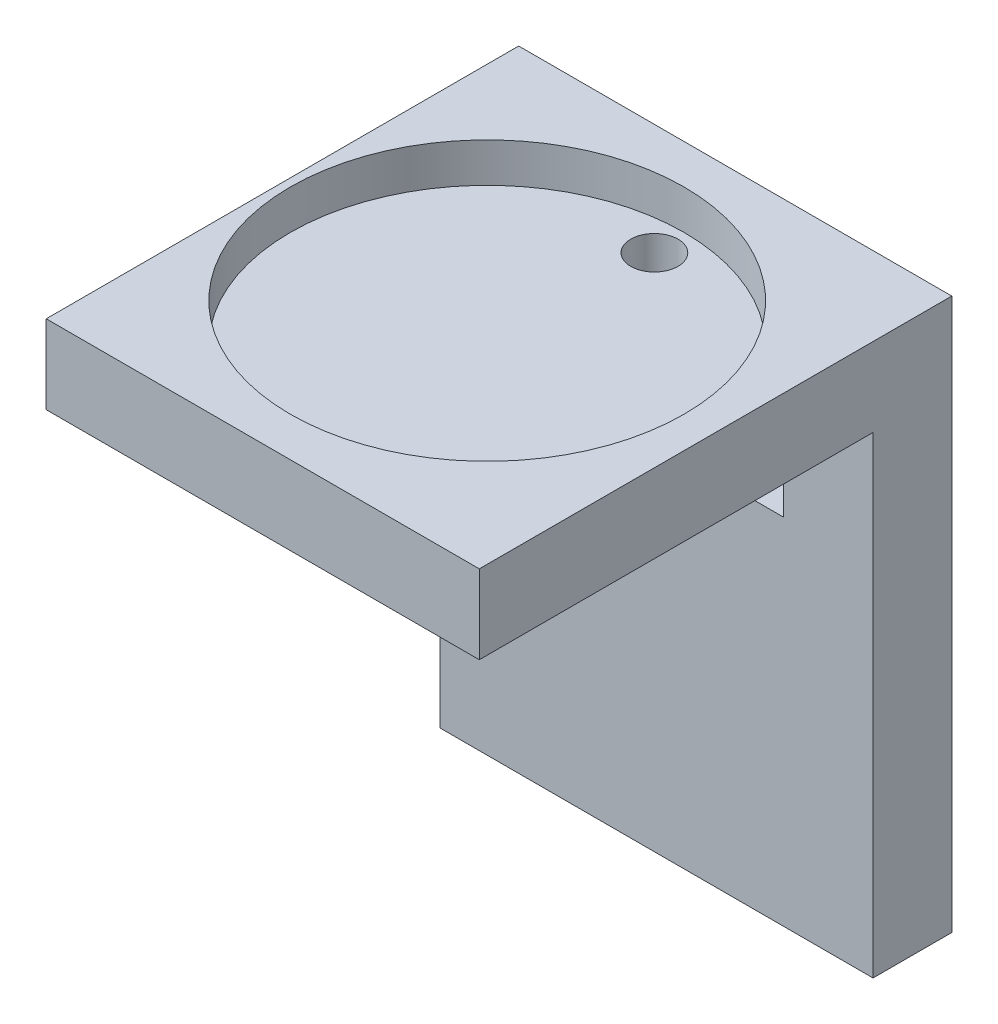
from build123d import *

# Parameters (mm, degrees)
SKETCH1_W                      = 670
SKETCH1_H                      = 120
BOSS_EXTRUDE1_DEPTH            = 530
SKETCH2_W                      = 100
SKETCH2_H                      = 200
SKETCH2_W_2                    = 650
SKETCH2_H_2                    = 250
CUT_EXTRUDE1_DEPTH             = 100
SKETCH3_R                      = 50
CUT_EXTRUDE2_DEPTH             = 260
F_12_0_12_DIAMETER_HOLE2_D     = 12
F_12_0_12_DIAMETER_HOLE2_DEPTH = 30
F_12_0_12_DIAMETER_HOLE2_TIP   = 3.605163714
SKETCH8_W                      = 650
SKETCH8_H                      = 50
BOSS_EXTRUDE2_DEPTH            = 5
SKETCH9_W                      = 10
SKETCH9_H                      = 250
CUT_EXTRUDE3_DEPTH             = 717
CUT_EXTRUDE4_DEPTH             = 5
SKETCH11_W                     = 10
SKETCH11_H                     = 100
BOSS_EXTRUDE3_DEPTH            = 78
BOSS_EXTRUDE3_2_DEPTH          = 78
BOSS_EXTRUDE3_3_DEPTH          = 78
SKETCH12_W                     = 20
SKETCH12_H                     = 30
CUT_EXTRUDE5_DEPTH             = 80
SKETCH15_W                     = 30
SKETCH15_H                     = 23.536156656
SKETCH15_H_2                   = 28.986603691
CUT_EXTRUDE7_DEPTH             = 35
SHELL1_T                       = -3
SKETCH16_W                     = 14
SKETCH16_H                     = 14
CUT_EXTRUDE8_DEPTH             = 35
SKETCH17_W                     = 5.729882812
SKETCH17_H                     = 17.428393554
SKETCH17_W_2                   = 13.369726562
SKETCH17_H_2                   = 3.342431641
BOSS_EXTRUDE4_DEPTH            = 5
CUT_EXTRUDE10_DEPTH            = 863.670273187
CUT_EXTRUDE10_DEPTH_BACK       = 863.670273187
SKETCH18_W                     = 670
SKETCH18_H                     = 250
CUT_EXTRUDE11_DEPTH            = 737.002717386
CUT_EXTRUDE11_DEPTH_BACK       = 737.002717386
SKETCH19_W                     = 448
SKETCH19_H                     = 280
SKETCH19_W_2                   = 112
CUT_EXTRUDE12_DEPTH            = 633.268930124
CUT_EXTRUDE12_DEPTH_BACK       = 633.268930124
SKETCH20_W                     = 110
SKETCH20_H                     = 140


with BuildPart() as part:
    # Sketch1 → Boss-Extrude1 (new body)
    with BuildSketch(Plane(origin=(0, 0, 0), x_dir=(1, 0, 0), z_dir=(0, 1, 0))):
        with Locations((335, 60)):
            Rectangle(SKETCH1_W, SKETCH1_H)
    extrude(amount=BOSS_EXTRUDE1_DEPTH)

    # Sketch2 → Cut-Extrude1 (cut)
    with BuildSketch(Plane.XY):
        with Locations((60, 380)):
            Rectangle(SKETCH2_W, SKETCH2_H)
        with Locations((170, 380)):
            Rectangle(SKETCH2_W, SKETCH2_H)
        with Locations((280, 380)):
            Rectangle(SKETCH2_W, SKETCH2_H)
        with Locations((390, 380)):
            Rectangle(SKETCH2_W, SKETCH2_H)
        with Locations((500, 380)):
            Rectangle(SKETCH2_W, SKETCH2_H)
        with Locations((610, 380)):
            Rectangle(SKETCH2_W, SKETCH2_H)
        with Locations((335, 135)):
            Rectangle(SKETCH2_W_2, SKETCH2_H_2)
    extrude(amount=-CUT_EXTRUDE1_DEPTH, mode=Mode.SUBTRACT)

    # Sketch3 → Cut-Extrude2 (cut)
    with BuildSketch(Plane(origin=(0, 530, 0), x_dir=(1, 0, 0), z_dir=(0, 1, 0))):
        with Locations(Location((60, 60, 0), (0, 0, 270))):
            Circle(SKETCH3_R)
        with Locations(Location((170, 60, 0), (0, 0, 270))):
            Circle(SKETCH3_R)
        with Locations(Location((280, 60, 0), (0, 0, 270))):
            Circle(SKETCH3_R)
        with Locations(Location((390, 60, 0), (0, 0, 270))):
            Circle(SKETCH3_R)
        with Locations(Location((500, 60, 0), (0, 0, 270))):
            Circle(SKETCH3_R)
        with Locations(Location((610, 60, 0), (0, 0, 270))):
            Circle(SKETCH3_R)
    extrude(amount=-CUT_EXTRUDE2_DEPTH, mode=Mode.SUBTRACT)

    # Ø12.0 (12) Diameter Hole2
    with Locations(Plane(origin=(59.704642413, 270, -102.411697903), x_dir=(0, 0, 1), z_dir=(0, 1, 0))):
        with Locations((0, 0), (-0.195888006, 111.8520513), (0.014838595, 221.167624818), (-0.341843303, 331.364008353), (0.657723149, 441.008646429), (1.288998006, 549.811854685)):
            Hole(F_12_0_12_DIAMETER_HOLE2_D / 2, depth=F_12_0_12_DIAMETER_HOLE2_DEPTH)
            with Locations((0, 0, -(F_12_0_12_DIAMETER_HOLE2_DEPTH + F_12_0_12_DIAMETER_HOLE2_TIP / 2))):  # 118° drill point
                Cone(0, F_12_0_12_DIAMETER_HOLE2_D / 2, F_12_0_12_DIAMETER_HOLE2_TIP, mode=Mode.SUBTRACT)

    # Sketch8 → Boss-Extrude2 (add)
    with BuildSketch(Plane.XY):
        with Locations((335, 305)):
            Rectangle(SKETCH8_W, SKETCH8_H)
    extrude(amount=-BOSS_EXTRUDE2_DEPTH)

    # Sketch9 → Cut-Extrude3 (cut)
    with BuildSketch(Plane(origin=(670, 0, 0), x_dir=(0, 0, -1), z_dir=(1, 0, 0))):
        with Locations((15, 135)):
            Rectangle(SKETCH9_W, SKETCH9_H)
    extrude(amount=-CUT_EXTRUDE3_DEPTH, mode=Mode.SUBTRACT)

    # Sketch10 → Cut-Extrude4 (cut)
    with BuildSketch(Plane(origin=(0, 10, 0), x_dir=(1, 0, 0), z_dir=(0, 1, 0))):
        Polygon((365, 61.943560596), (350, 87.924322709), (320, 87.924322709), (305, 61.943560596), (320, 35.962798482), (350, 35.962798482), align=None)
    extrude(amount=-CUT_EXTRUDE4_DEPTH, mode=Mode.SUBTRACT)

    # Sketch12 → Cut-Extrude5 (cut)
    with BuildSketch(Plane.XY.offset(-100)):
        with Locations((85.198613037, 245)):
            Rectangle(SKETCH12_W, SKETCH12_H)
        with Locations((195.198613037, 245)):
            Rectangle(SKETCH12_W, SKETCH12_H)
        with Locations((305.198613037, 245)):
            Rectangle(SKETCH12_W, SKETCH12_H)
        with Locations((415.198613037, 245)):
            Rectangle(SKETCH12_W, SKETCH12_H)
        with Locations((525.198613037, 245)):
            Rectangle(SKETCH12_W, SKETCH12_H)
        with Locations((635.198613037, 245)):
            Rectangle(SKETCH12_W, SKETCH12_H)
    extrude(amount=-CUT_EXTRUDE5_DEPTH, mode=Mode.SUBTRACT)

    # Sketch17 → Boss-Extrude4 (add)
    # profile 1 of 9: a face of its own
    with BuildSketch(Plane.XY):
        with BuildLine():
            Line((527.508830928, 289.835452458), (527.508830928, 307.263846012))
            Line((527.508830928, 307.263846012), (534.861434459, 307.263846012))
            add(Edge.make_bspline(
                [(534.861434459, 307.263846012), (535.181337774, 307.258256848), (535.803061116, 307.24739446), (536.703508491, 307.139069344), (537.544992916, 306.975202489), (538.325061607, 306.737496792), (539.040841948, 306.426020155), (539.698044515, 306.051894954), (540.290333057, 305.605079277), (540.822348212, 305.090232636), (541.284521701, 304.502523111), (541.692171296, 303.852565801), (542.030284458, 303.129762281), (542.309377095, 302.341316546), (542.5243908, 301.484161689), (542.679660381, 300.560045938), (542.773357357, 299.567500804), (542.783368073, 298.883107022), (542.788518428, 298.530997273)],
                knots=[0, 0, 0, 0, 1.135059408, 2.20595691, 3.214417064, 4.174978569, 5.094187092, 5.980001006, 6.853065862, 7.720814779, 8.600404634, 9.50058483, 10.438414914, 11.426825708, 12.465239141, 13.571113463, 14.750376389, 16, 16, 16, 16], degree=3))
            add(Edge.make_bspline(
                [(542.788518428, 298.530997273), (542.781740751, 298.180151665), (542.768592871, 297.499553336), (542.676885992, 296.511518461), (542.516733301, 295.591080531), (542.296748778, 294.736450427), (542.003051046, 293.953120444), (541.654236167, 293.233205539), (541.233025793, 292.585291498), (540.753136904, 292.000029304), (540.204772188, 291.484681411), (539.587651059, 291.044279297), (538.910779309, 290.668464036), (538.169670382, 290.361903209), (537.364073889, 290.124869172), (536.495133477, 289.954199984), (535.562644449, 289.853487388), (534.920131033, 289.841584621), (534.58911581, 289.835452458)],
                knots=[0, 0, 0, 0, 1.228418252, 2.382983832, 3.470276728, 4.496757894, 5.468023682, 6.394867725, 7.292157164, 8.167372942, 9.039072913, 9.918728341, 10.815246345, 11.744296628, 12.720973084, 13.750736166, 14.841206188, 16, 16, 16, 16], degree=3))
            Line((534.58911581, 289.835452458), (527.508830928, 289.835452458))
        make_face()
        with BuildLine():
            Line((533.238713741, 291.745413395), (534.048208904, 291.745413395))
            add(Edge.make_bspline(
                [(534.048208904, 291.745413395), (534.172894012, 291.749291978), (534.413033311, 291.756761998), (534.758676231, 291.825976613), (535.075745017, 291.938271137), (535.365749176, 292.094802589), (535.623404602, 292.300450923), (535.848862806, 292.551404902), (536.04776914, 292.844737637), (536.217685755, 293.190205032), (536.364284647, 293.596533622), (536.481764702, 294.076367921), (536.592118304, 294.630928744), (536.673672739, 295.265507643), (536.740044562, 295.978448886), (536.788346679, 296.768428292), (536.812018936, 297.636801208), (536.817188964, 298.241258393), (536.819890499, 298.55711002)],
                knots=[0, 0, 0, 0, 0.728710832, 1.403472396, 2.052289494, 2.690292559, 3.321919393, 3.970736491, 4.656696891, 5.388631723, 6.217040872, 7.17856157, 8.275589967, 9.523440737, 10.918935818, 12.463926104, 14.152268318, 16, 16, 16, 16], degree=3))
            add(Edge.make_bspline(
                [(536.819890499, 298.55711002), (536.8171426, 298.871715251), (536.811863063, 299.476166083), (536.7886758, 300.343334385), (536.739579947, 301.133216935), (536.674703848, 301.843934916), (536.589660404, 302.476324031), (536.488366458, 303.031681737), (536.362441588, 303.507627045), (536.222158727, 303.914921549), (536.050140993, 304.256514038), (535.858357073, 304.554097881), (535.62547107, 304.79746827), (535.36991257, 305.004888479), (535.079348843, 305.160875844), (534.761320266, 305.273944358), (534.414185903, 305.34216807), (534.172870641, 305.349893944), (534.048208904, 305.353885075)],
                knots=[0, 0, 0, 0, 1.842836665, 3.540640921, 5.080358154, 6.47765669, 7.719902824, 8.816971715, 9.781579111, 10.601733135, 11.334613876, 12.017393917, 12.666641099, 13.29908421, 13.937911793, 14.587567384, 15.270347425, 16, 16, 16, 16], degree=3))
            Line((534.048208904, 305.353885075), (533.238713741, 305.353885075))
            Line((533.238713741, 305.353885075), (533.238713741, 291.745413395))
        make_face(mode=Mode.SUBTRACT)
    # profile 2 of 9: a face of its own
    with BuildSketch(Plane.XY):
        with Locations((547.563420772, 298.549649235)):
            Rectangle(SKETCH17_W, SKETCH17_H)
    # profile 3 of 9: a face of its own
    with BuildSketch(Plane.XY):
        Polygon((564.514324092, 307.263846012), (564.514324092, 305.115139958), (558.545696163, 305.115139958), (558.545696163, 299.862747379), (563.559343624, 299.862747379), (563.559343624, 297.714041325), (558.545696163, 297.714041325), (558.545696163, 289.835452458), (552.81581335, 289.835452458), (552.81581335, 307.263846012), align=None)
    # profile 4 of 9: a face of its own
    with BuildSketch(Plane.XY):
        Polygon((577.645305538, 307.263846012), (577.645305538, 305.115139958), (571.676677608, 305.115139958), (571.676677608, 299.862747379), (576.690325069, 299.862747379), (576.690325069, 297.714041325), (571.676677608, 297.714041325), (571.676677608, 289.835452458), (565.946794795, 289.835452458), (565.946794795, 307.263846012), align=None)
    # profile 5 of 9: a face of its own
    with BuildSketch(Plane.XY):
        with Locations((584.330168819, 287.448001286)):
            Rectangle(SKETCH17_W_2, SKETCH17_H_2)
    # profile 6 of 9: a face of its own
    with BuildSketch(Plane.XY):
        with BuildLine():
            Line((605.578484249, 307.263846012), (605.578484249, 295.602639195))
            add(Edge.make_bspline(
                [(605.578484249, 295.602639195), (605.574209777, 295.35989389), (605.565919345, 294.889083964), (605.480877158, 294.20653885), (605.349958188, 293.569747554), (605.15926554, 292.978838165), (604.911867049, 292.436847071), (604.616163877, 291.936663973), (604.260702644, 291.487723021), (603.847299908, 291.08966617), (603.386881991, 290.731670113), (602.867295001, 290.425440037), (602.293741958, 290.168488385), (601.66690529, 289.960990771), (600.988052682, 289.797299786), (600.254912883, 289.679078851), (599.467035781, 289.60781007), (598.923618241, 289.60048219), (598.643684673, 289.59670734)],
                knots=[0, 0, 0, 0, 1.108173197, 2.149326602, 3.136215123, 4.073726706, 4.978516626, 5.852185058, 6.72141202, 7.584905625, 8.467554395, 9.379216169, 10.332422268, 11.332766067, 12.390653242, 13.518530507, 14.721707419, 16, 16, 16, 16], degree=3))
            add(Edge.make_bspline(
                [(598.643684673, 289.59670734), (598.373688491, 289.600411437), (597.851346557, 289.607577482), (597.093280473, 289.679448684), (596.387523889, 289.797736542), (595.733050135, 289.960122315), (595.130189942, 290.169220301), (594.579048171, 290.42623041), (594.078350789, 290.732835498), (593.633858028, 291.090104794), (593.234289459, 291.486851767), (592.899913678, 291.940746827), (592.609043638, 292.435866034), (592.375223767, 292.980322997), (592.191754821, 293.570441519), (592.063541006, 294.20666921), (591.983676196, 294.889343196), (591.974661767, 295.359932437), (591.970012569, 295.602639195)],
                knots=[0, 0, 0, 0, 1.258901956, 2.435505865, 3.547148904, 4.59359074, 5.576649289, 6.5183682, 7.424469602, 8.307507093, 9.172751023, 10.042627298, 10.928839176, 11.845659241, 12.799442865, 13.80597989, 14.868432463, 16, 16, 16, 16], degree=3))
            Line((591.970012569, 295.602639195), (591.970012569, 307.263846012))
            Line((591.970012569, 307.263846012), (597.699895381, 307.263846012))
            Line((597.699895381, 307.263846012), (597.699895381, 295.457153889))
            add(Edge.make_bspline(
                [(597.699895381, 295.457153889), (597.700816195, 295.287996189), (597.702584578, 294.963135903), (597.729908723, 294.499051493), (597.768241004, 294.079064133), (597.828226169, 293.705517832), (597.90066041, 293.377063412), (597.989882091, 293.09281535), (598.094998068, 292.852496478), (598.225239063, 292.654232043), (598.380826623, 292.495135011), (598.55368342, 292.353231761), (598.757556996, 292.238543846), (598.987648905, 292.146224908), (599.243380948, 292.070549638), (599.526120553, 292.020376099), (599.83553351, 291.990763905), (600.049971942, 291.986424568), (600.161954402, 291.984158512)],
                knots=[0, 0, 0, 0, 1.622370975, 3.115695595, 4.458049099, 5.666011203, 6.742434742, 7.681714947, 8.519814998, 9.250928664, 9.942747364, 10.646898194, 11.389596108, 12.175933929, 13.021386247, 13.943159715, 14.925891993, 16, 16, 16, 16], degree=3))
            add(Edge.make_bspline(
                [(600.161954402, 291.984158512), (600.283927219, 291.987190593), (600.521124756, 291.993087005), (600.86597014, 292.03390861), (601.187714881, 292.103380086), (601.484890424, 292.205377303), (601.758665297, 292.332852529), (602.012761516, 292.484567923), (602.236391413, 292.674631152), (602.439076761, 292.888441291), (602.620738276, 293.128529789), (602.771757722, 293.399928575), (602.905501548, 293.697121508), (603.005823683, 294.025060118), (603.089837826, 294.379999499), (603.146989706, 294.763086929), (603.186210275, 295.174074524), (603.189394751, 295.457053988), (603.191033077, 295.602639195)],
                knots=[0, 0, 0, 0, 1.083870311, 2.107775948, 3.08105344, 4.003637981, 4.893545291, 5.761570557, 6.624657808, 7.49233129, 8.376387281, 9.291996285, 10.246843261, 11.267344133, 12.334180325, 13.486053461, 14.706643157, 16, 16, 16, 16], degree=3))
            Line((603.191033077, 295.602639195), (603.191033077, 307.263846012))
            Line((603.191033077, 307.263846012), (605.578484249, 307.263846012))
        make_face()
    # profile 7 of 9: a face of its own
    with BuildSketch(Plane.XY):
        with BuildLine():
            Line((619.731593227, 302.015183827), (616.739818477, 301.526502415))
            add(Edge.make_bspline(
                [(616.739818477, 301.526502415), (616.748849224, 301.670726223), (616.765660669, 301.939210177), (616.78429066, 302.312269209), (616.796668381, 302.625642376), (616.798628236, 302.814722915), (616.799504756, 302.899286839)],
                knots=[0, 0, 0, 0, 1.261802504, 2.348944521, 3.261585937, 4, 4, 4, 4], degree=3))
            add(Edge.make_bspline(
                [(616.799504756, 302.899286839), (616.798306068, 303.007660677), (616.795968139, 303.219033721), (616.750451916, 303.523894877), (616.694806916, 303.811547356), (616.604352699, 304.076787391), (616.488181329, 304.320314265), (616.348943917, 304.543955606), (616.184187178, 304.745078709), (615.995833421, 304.928129987), (615.778009957, 305.083200131), (615.536269472, 305.218702836), (615.269765326, 305.333844758), (614.978065514, 305.431346685), (614.660683072, 305.504624438), (614.319025281, 305.556776695), (613.952471696, 305.585673441), (613.699597795, 305.590260771), (613.568984889, 305.592630192)],
                knots=[0, 0, 0, 0, 1.079280541, 2.105035848, 3.067950317, 3.99715044, 4.889989748, 5.753421302, 6.617030865, 7.476358039, 8.364190572, 9.274590025, 10.235106994, 11.254473582, 12.337095886, 13.478601727, 14.697662529, 16, 16, 16, 16], degree=3))
            add(Edge.make_bspline(
                [(613.568984889, 305.592630192), (613.391954632, 305.58912286), (613.059112606, 305.582528579), (612.595688488, 305.495339748), (612.198743126, 305.361419257), (611.87165349, 305.163811893), (611.613188167, 304.909795747), (611.433841092, 304.593316589), (611.323009072, 304.224665915), (611.313400221, 303.959558324), (611.308367061, 303.820693775)],
                knots=[0, 0, 0, 0, 1.294917039, 2.43462794, 3.440028966, 4.347597256, 5.210608309, 6.06356377, 6.985685997, 8, 8, 8, 8], degree=3))
            add(Edge.make_bspline(
                [(611.308367061, 303.820693775), (611.317562032, 303.705133219), (611.336106628, 303.472068433), (611.47315858, 303.132808312), (611.695999602, 302.811560885), (612.009295906, 302.510664216), (612.404107796, 302.221967273), (612.884407504, 301.948533431), (613.450813789, 301.688189695), (613.862519081, 301.536023727), (614.080048656, 301.455624958)],
                knots=[0, 0, 0, 0, 0.716839541, 1.445735977, 2.240793036, 3.131329288, 4.131129903, 5.273471266, 6.559404876, 8, 8, 8, 8], degree=3))
            add(Edge.make_bspline(
                [(614.080048656, 301.455624958), (614.335934702, 301.364918412), (614.834564244, 301.188164095), (615.547657928, 300.88707802), (616.213068388, 300.5749594), (616.829579094, 300.246613346), (617.397833174, 299.90520698), (617.914851624, 299.544556457), (618.386199073, 299.173962102), (618.807001026, 298.783874588), (619.177995113, 298.378100064), (619.4958685, 297.952745357), (619.771807525, 297.51723103), (619.991113975, 297.061458502), (620.169645242, 296.594624218), (620.292698657, 296.11024444), (620.364288243, 295.609761088), (620.37516617, 295.270864226), (620.380681514, 295.099036213)],
                knots=[0, 0, 0, 0, 1.359488612, 2.649152603, 3.874964776, 5.039588756, 6.146130126, 7.193090393, 8.194917302, 9.146793662, 10.063845301, 10.944476293, 11.803344532, 12.641736646, 13.473440096, 14.302714936, 15.139439897, 16, 16, 16, 16], degree=3))
            add(Edge.make_bspline(
                [(620.380681514, 295.099036213), (620.374476075, 294.902306495), (620.362285176, 294.515820995), (620.280160209, 293.948630617), (620.138011896, 293.409496554), (619.938489338, 292.895972278), (619.681049879, 292.411946655), (619.366518754, 291.954381076), (618.996510229, 291.525099427), (618.5710008, 291.128381035), (618.102222518, 290.765302239), (617.587803957, 290.450854345), (617.034458515, 290.187092261), (616.444107988, 289.968993032), (615.81453624, 289.801373099), (615.145337453, 289.685291013), (614.438790193, 289.606619894), (613.954683001, 289.600062276), (613.70700941, 289.59670734)],
                knots=[0, 0, 0, 0, 0.972121714, 1.909782367, 2.824924061, 3.721832975, 4.62620438, 5.527836938, 6.46026819, 7.421000932, 8.398101015, 9.385579713, 10.394244048, 11.422703992, 12.491421888, 13.608778581, 14.776629625, 16, 16, 16, 16], degree=3))
            add(Edge.make_bspline(
                [(613.70700941, 289.59670734), (613.445745367, 289.599650312), (612.939893069, 289.605348413), (612.207608113, 289.66709241), (611.525297432, 289.760984454), (610.893395078, 289.899706116), (610.309273131, 290.072394336), (609.776099392, 290.288320955), (609.295310255, 290.547303481), (608.863217672, 290.843007892), (608.478306623, 291.175775461), (608.148120946, 291.551766865), (607.86942369, 291.967163224), (607.639947144, 292.421521488), (607.466477665, 292.917583541), (607.339164663, 293.449829748), (607.264537999, 294.021332449), (607.254747521, 294.414908557), (607.249700069, 294.617815586)],
                knots=[0, 0, 0, 0, 1.342201143, 2.598733168, 3.773451092, 4.878874364, 5.91991243, 6.900006476, 7.829142054, 8.72062616, 9.585588575, 10.436728592, 11.283829734, 12.149664931, 13.044964919, 13.977937424, 14.957531465, 16, 16, 16, 16], degree=3))
            add(Edge.make_bspline(
                [(607.249700069, 294.617815586), (607.250803815, 294.692425759), (607.253213998, 294.855347393), (607.260452266, 295.122772538), (607.275636683, 295.433682216), (607.29037174, 295.656130545), (607.298195171, 295.774237248)],
                knots=[0, 0, 0, 0, 0.773500207, 1.689044709, 2.77302154, 4, 4, 4, 4], degree=3))
            Line((607.298195171, 295.774237248), (610.36457777, 296.337526509))
            add(Edge.make_bspline(
                [(610.36457777, 296.337526509), (610.326952988, 296.136337493), (610.255606535, 295.754830366), (610.178678473, 295.21219969), (610.124206629, 294.733311493), (610.11767002, 294.435147371), (610.114641475, 294.297001835)],
                knots=[0, 0, 0, 0, 1.192988372, 2.262218769, 3.194850416, 4, 4, 4, 4], degree=3))
            add(Edge.make_bspline(
                [(610.114641475, 294.297001835), (610.116191817, 294.183708768), (610.119182568, 293.965156219), (610.159053378, 293.648552813), (610.215988606, 293.352999663), (610.302906772, 293.079707227), (610.411206928, 292.826307836), (610.544682453, 292.59538211), (610.704385489, 292.386485019), (610.887496571, 292.200099922), (611.094689168, 292.033628705), (611.327456494, 291.892756696), (611.58347653, 291.771733922), (611.864681562, 291.677479524), (612.167961721, 291.596080628), (612.497219749, 291.548235723), (612.849461228, 291.512043782), (613.092629543, 291.508500084), (613.218327999, 291.506668278)],
                knots=[0, 0, 0, 0, 1.135776692, 2.191015738, 3.19649269, 4.151244236, 5.061952528, 5.956281389, 6.819534407, 7.692823504, 8.571441916, 9.478554956, 10.416037156, 11.406231466, 12.450054172, 13.561596327, 14.739541482, 16, 16, 16, 16], degree=3))
            add(Edge.make_bspline(
                [(613.218327999, 291.506668278), (613.423996012, 291.510791273), (613.810619321, 291.518541853), (614.349272542, 291.616708407), (614.810575885, 291.768742445), (615.189785268, 291.991387532), (615.490778961, 292.278756613), (615.698005174, 292.637320004), (615.824813318, 293.05638326), (615.837728413, 293.355975238), (615.844524288, 293.513619419)],
                knots=[0, 0, 0, 0, 1.308765556, 2.460272085, 3.475015317, 4.388076298, 5.239673503, 6.095681635, 6.997954785, 8, 8, 8, 8], degree=3))
            add(Edge.make_bspline(
                [(615.844524288, 293.513619419), (615.833808824, 293.638242951), (615.811807312, 293.894126055), (615.644884004, 294.264515838), (615.382382362, 294.620631473), (615.016807277, 294.962984909), (614.551376589, 295.293471235), (613.986957743, 295.616730224), (613.322148235, 295.933112033), (612.83677959, 296.119639164), (612.580430889, 296.21815395)],
                knots=[0, 0, 0, 0, 0.667930748, 1.371427933, 2.146459016, 3.034714139, 4.04893387, 5.207327294, 6.525042705, 8, 8, 8, 8], degree=3))
            add(Edge.make_bspline(
                [(612.580430889, 296.21815395), (612.374354345, 296.29679374), (611.970646869, 296.450850434), (611.394079385, 296.713586304), (610.853066711, 296.987016804), (610.357486361, 297.288235735), (609.896382561, 297.599610528), (609.477036946, 297.932256792), (609.09841673, 298.284556341), (608.758710772, 298.653375077), (608.457302107, 299.038989264), (608.199448649, 299.444659231), (607.977533299, 299.866789834), (607.798609588, 300.308107488), (607.65975715, 300.767821241), (607.559616231, 301.244439392), (607.497905054, 301.739995674), (607.491630423, 302.075933546), (607.488445186, 302.246468159)],
                knots=[0, 0, 0, 0, 1.249558333, 2.447906163, 3.58867143, 4.682264114, 5.731748367, 6.739728761, 7.711906036, 8.659384707, 9.578321416, 10.481344598, 11.379544271, 12.277135726, 13.175418307, 14.097160112, 15.034047388, 16, 16, 16, 16], degree=3))
            add(Edge.make_bspline(
                [(607.488445186, 302.246468159), (607.49282555, 302.439538736), (607.501402184, 302.817565692), (607.587451154, 303.36980586), (607.719291893, 303.894921371), (607.910558542, 304.389343064), (608.156192894, 304.852853762), (608.453187669, 305.288766511), (608.804241719, 305.697593471), (609.213503754, 306.066686531), (609.657214714, 306.407618241), (610.14376173, 306.697651931), (610.658716537, 306.950861947), (611.210636666, 307.148827868), (611.791820619, 307.313252612), (612.408080529, 307.421140415), (613.056315391, 307.490701612), (613.499160755, 307.498567824), (613.725661373, 307.502591129)],
                knots=[0, 0, 0, 0, 1.01033566, 1.978209831, 2.919499157, 3.840961976, 4.746855014, 5.660740114, 6.597989116, 7.56120833, 8.541877795, 9.523498025, 10.522416858, 11.542172371, 12.589598349, 13.681636521, 14.814234488, 16, 16, 16, 16], degree=3))
            add(Edge.make_bspline(
                [(613.725661373, 307.502591129), (613.968269855, 307.498219033), (614.438190994, 307.489750488), (615.120391152, 307.426787419), (615.755073228, 307.319142339), (616.345153155, 307.171557286), (616.887304575, 306.977590666), (617.384933999, 306.742393454), (617.834452216, 306.46201507), (618.236961315, 306.139451502), (618.593086714, 305.773322851), (618.897467704, 305.361641069), (619.158701245, 304.909408454), (619.366684143, 304.412232174), (619.529870326, 303.873247147), (619.649133834, 303.29158184), (619.720420497, 302.667301443), (619.72779778, 302.236712324), (619.731593227, 302.015183827)],
                knots=[0, 0, 0, 0, 1.248314423, 2.417925914, 3.521398822, 4.558068205, 5.543720209, 6.479599284, 7.385061127, 8.263440163, 9.127722873, 10.00561236, 10.891325273, 11.808802823, 12.772251995, 13.784947978, 14.860405143, 16, 16, 16, 16], degree=3))
        make_face()
    # profile 8 of 9: a face of its own
    with BuildSketch(Plane.XY):
        Polygon((633.989153194, 307.263846012), (633.989153194, 305.115139958), (628.020525264, 305.115139958), (628.020525264, 300.340237614), (633.034172725, 300.340237614), (633.034172725, 298.191531559), (628.020525264, 298.191531559), (628.020525264, 291.984158512), (634.944133663, 291.984158512), (634.944133663, 289.835452458), (622.290642452, 289.835452458), (622.290642452, 307.263846012), align=None)
    # profile 9 of 9: a face of its own
    with BuildSketch(Plane.XY):
        with BuildLine():
            Line((636.376604366, 289.835452458), (636.376604366, 307.263846012))
            Line((636.376604366, 307.263846012), (643.990335369, 307.263846012))
            add(Edge.make_bspline(
                [(643.990335369, 307.263846012), (644.237946498, 307.261150834), (644.721600887, 307.25588639), (645.426490561, 307.189203683), (646.094808274, 307.090496236), (646.724915796, 306.949857504), (647.317873659, 306.767252686), (647.871119087, 306.542146), (648.390701058, 306.282329135), (648.864494846, 305.976472528), (649.295093616, 305.642889252), (649.669668547, 305.279483604), (649.990389523, 304.894749072), (650.250664962, 304.483256345), (650.454275633, 304.048690948), (650.59581384, 303.587791605), (650.684089268, 303.104102537), (650.695510601, 302.772834174), (650.701311397, 302.604585835)],
                knots=[0, 0, 0, 0, 1.303269877, 2.545653735, 3.724355284, 4.8584284, 5.941462088, 6.987020715, 8.000098032, 8.995332524, 9.951400474, 10.863507538, 11.737823931, 12.582415999, 13.420128714, 14.25671499, 15.114600608, 16, 16, 16, 16], degree=3))
            add(Edge.make_bspline(
                [(650.701311397, 302.604585835), (650.698282873, 302.472674957), (650.692382063, 302.215658276), (650.651041486, 301.838684287), (650.580643818, 301.480313933), (650.481036683, 301.139915259), (650.347814833, 300.820175594), (650.191279492, 300.517863507), (650.009772227, 300.230553342), (649.788675198, 299.970497982), (649.548268341, 299.722842359), (649.274558803, 299.497116911), (648.974487035, 299.288655528), (648.642526299, 299.104010513), (648.287619671, 298.928055749), (647.899038177, 298.784921972), (647.486819978, 298.644749395), (647.19793098, 298.577036306), (647.049257183, 298.54218845)],
                knots=[0, 0, 0, 0, 1.057156483, 2.059775939, 3.035078039, 3.981068617, 4.897189472, 5.80650904, 6.70770952, 7.613691521, 8.536886357, 9.470937334, 10.45233069, 11.461024139, 12.51295332, 13.623444893, 14.776929983, 16, 16, 16, 16], degree=3))
            add(Edge.make_bspline(
                [(647.049257183, 298.54218845), (647.19164695, 298.499279419), (647.467865022, 298.416041346), (647.856360945, 298.265600017), (648.211652989, 298.111536308), (648.524185739, 297.936781388), (648.807636894, 297.762122504), (649.047122259, 297.564301324), (649.255235567, 297.361673563), (649.425188343, 297.135464734), (649.570253643, 296.882344437), (649.694827156, 296.586596707), (649.815179167, 296.247423665), (649.917667348, 295.859098311), (650.004750555, 295.423699276), (650.088222437, 294.944027189), (650.153853601, 294.416024546), (650.187587341, 294.048412906), (650.2051692, 293.856815525)],
                knots=[0, 0, 0, 0, 1.149282524, 2.229462177, 3.219229774, 4.139917433, 4.995948464, 5.788695735, 6.536448429, 7.236319808, 7.968460079, 8.78645307, 9.713791991, 10.749194692, 11.887975363, 13.146018663, 14.512518948, 16, 16, 16, 16], degree=3))
            add(Edge.make_bspline(
                [(650.2051692, 293.856815525), (650.225980287, 293.627849833), (650.265975604, 293.187817268), (650.348933081, 292.554613589), (650.44386163, 291.974357025), (650.555874504, 291.44528724), (650.681301216, 290.967898855), (650.821280597, 290.540469593), (650.979920039, 290.165788217), (651.10484481, 289.941461656), (651.163880062, 289.835452458)],
                knots=[0, 0, 0, 0, 1.324580516, 2.545615266, 3.678710841, 4.711533017, 5.660403917, 6.521349952, 7.301239649, 8, 8, 8, 8], degree=3))
            Line((651.163880062, 289.835452458), (645.213904094, 289.835452458))
            add(Edge.make_bspline(
                [(645.213904094, 289.835452458), (645.12229736, 290.069847279), (644.935171241, 290.548648246), (644.7595281, 291.319414791), (644.64846922, 292.142514735), (644.635117598, 292.70994511), (644.628232479, 293.002555653)],
                knots=[0, 0, 0, 0, 0.930410518, 1.900560147, 2.917368081, 4, 4, 4, 4], degree=3))
            Line((644.628232479, 293.002555653), (644.605850124, 294.002300831))
            Line((644.605850124, 294.002300831), (644.579737377, 295.266903874))
            add(Edge.make_bspline(
                [(644.579737377, 295.266903874), (644.573694669, 295.477395004), (644.562357007, 295.872330118), (644.469348432, 296.426164013), (644.30178735, 296.894645884), (644.073222546, 297.287223005), (643.766741442, 297.590613479), (643.39104803, 297.804152917), (642.950456912, 297.93396284), (642.634664848, 297.946292392), (642.468335247, 297.952786442)],
                knots=[0, 0, 0, 0, 1.295300309, 2.430314163, 3.439929415, 4.342995669, 5.203512789, 6.060756153, 6.978588463, 8, 8, 8, 8], degree=3))
            Line((642.468335247, 297.952786442), (642.106487178, 297.952786442))
            Line((642.106487178, 297.952786442), (642.106487178, 289.835452458))
            Line((642.106487178, 289.835452458), (636.376604366, 289.835452458))
        make_face()
        with BuildLine():
            Line((642.106487178, 299.862747379), (642.617550945, 299.862747379))
            add(Edge.make_bspline(
                [(642.617550945, 299.862747379), (642.722054451, 299.865172716), (642.925280724, 299.869889229), (643.220054897, 299.898289891), (643.494111408, 299.951809873), (643.749840966, 300.021017819), (643.984372137, 300.114851792), (644.200147241, 300.225818296), (644.391160406, 300.362685327), (644.565327067, 300.516342321), (644.718148635, 300.691986294), (644.850351299, 300.889034217), (644.961199162, 301.106225057), (645.056078491, 301.342818683), (645.125883912, 301.600830857), (645.173262731, 301.879472914), (645.203404658, 302.177423605), (645.207875435, 302.383174491), (645.210173702, 302.488943669)],
                knots=[0, 0, 0, 0, 1.184986479, 2.304423995, 3.352332712, 4.347714965, 5.303263624, 6.211353909, 7.091434645, 7.960150225, 8.839440182, 9.723126897, 10.64371617, 11.599264829, 12.608232147, 13.667459739, 14.800924404, 16, 16, 16, 16], degree=3))
            add(Edge.make_bspline(
                [(645.210173702, 302.488943669), (645.207875435, 302.594712847), (645.203404658, 302.800463732), (645.173262731, 303.098414423), (645.125883912, 303.37705648), (645.056078491, 303.635068654), (644.961199162, 303.87166228), (644.850351299, 304.08885312), (644.718148635, 304.285901043), (644.565327067, 304.461545017), (644.391160406, 304.61520201), (644.200147241, 304.752069041), (643.984372137, 304.863035546), (643.749840966, 304.956869518), (643.494111408, 305.026077464), (643.220054897, 305.079597446), (642.925280724, 305.107998108), (642.722054451, 305.112714621), (642.617550945, 305.115139958)],
                knots=[0, 0, 0, 0, 1.199075596, 2.332540261, 3.391767853, 4.400735171, 5.35628383, 6.276873103, 7.160559818, 8.039849775, 8.908565355, 9.788646091, 10.696736376, 11.652285035, 12.647667288, 13.695576005, 14.815013521, 16, 16, 16, 16], degree=3))
            Line((642.617550945, 305.115139958), (642.106487178, 305.115139958))
            Line((642.106487178, 305.115139958), (642.106487178, 299.862747379))
        make_face(mode=Mode.SUBTRACT)
    extrude(amount=BOSS_EXTRUDE4_DEPTH)

    # Sketch18 → Cut-Extrude10 (cut, two sides: drawn at the far end of the back side and taken through both)
    with BuildSketch(Plane.XY.offset(-CUT_EXTRUDE10_DEPTH_BACK)):
        with Locations((335, 405)):
            Rectangle(SKETCH18_W, SKETCH18_H)
    extrude(amount=CUT_EXTRUDE10_DEPTH + CUT_EXTRUDE10_DEPTH_BACK, mode=Mode.SUBTRACT)

    # Sketch19 → Cut-Extrude11 (cut, two sides: drawn at the far end of the back side and taken through both)
    with BuildSketch(Plane(origin=(0, 0, -120), x_dir=(-1, 0, 0), z_dir=(0, 0, -1)).offset(-CUT_EXTRUDE11_DEPTH_BACK)):
        with Locations((-224, 140)):
            Rectangle(SKETCH19_W, SKETCH19_H)
        with Locations((-614, 140)):
            Rectangle(SKETCH19_W_2, SKETCH19_H)
    extrude(amount=CUT_EXTRUDE11_DEPTH + CUT_EXTRUDE11_DEPTH_BACK, mode=Mode.SUBTRACT)

    # Sketch20 → Cut-Extrude12 (cut, two sides: drawn at the far end of the back side and taken through both)
    with BuildSketch(Plane.XY.offset(-100).offset(-CUT_EXTRUDE12_DEPTH_BACK)):
        with Locations((503, 70)):
            Rectangle(SKETCH20_W, SKETCH20_H)
    extrude(amount=CUT_EXTRUDE12_DEPTH + CUT_EXTRUDE12_DEPTH_BACK, mode=Mode.SUBTRACT)


with BuildPart() as body_2:
    # Sketch11 → Boss-Extrude3 (new body)
    with BuildSketch(Plane.XY.offset(-100)):
        with Locations((255, 60)):
            Rectangle(SKETCH11_W, SKETCH11_H)
    extrude(amount=BOSS_EXTRUDE3_DEPTH)


with BuildPart() as body_3:
    # Sketch11 → Boss-Extrude3 2 (new body)
    with BuildSketch(Plane.XY.offset(-100)):
        with Locations((415, 60)):
            Rectangle(SKETCH11_W, SKETCH11_H)
    extrude(amount=BOSS_EXTRUDE3_2_DEPTH)


with BuildPart() as body_4:
    # Sketch11 → Boss-Extrude3 3 (new body)
    with BuildSketch(Plane.XY.offset(-100)):
        Polygon((25, 198.45686471), (325, 145.558770497), (325, 122.01775856), (345, 122.01775856), (345, 145.558770497), (645, 198.45686471), align=None)
    extrude(amount=BOSS_EXTRUDE3_3_DEPTH)

    # Sketch15 → Cut-Extrude7 (cut)
    with BuildSketch(Plane(origin=(345, 0, 0), x_dir=(0, 0, -1), z_dir=(1, 0, 0))):
        with Locations((35, 133.231921672)):
            Rectangle(SKETCH15_W, SKETCH15_H)
        with Locations((85, 130.506698154)):
            Rectangle(SKETCH15_W, SKETCH15_H_2)
    extrude(amount=-CUT_EXTRUDE7_DEPTH, mode=Mode.SUBTRACT)

    # Shell1
    shell1_openings = [body_4.faces().sort_by_distance(p)[0] for p in [
        (335, 198.45686471, -61),
    ]]
    offset(amount=SHELL1_T, openings=shell1_openings, kind=Kind.INTERSECTION)

    # Sketch16 → Cut-Extrude8 (cut)
    with BuildSketch(Plane.XZ.offset(-122.01775856)):
        with Locations((335, -60)):
            Rectangle(SKETCH16_W, SKETCH16_H)
    extrude(amount=-CUT_EXTRUDE8_DEPTH, mode=Mode.SUBTRACT)


solid = part.part
